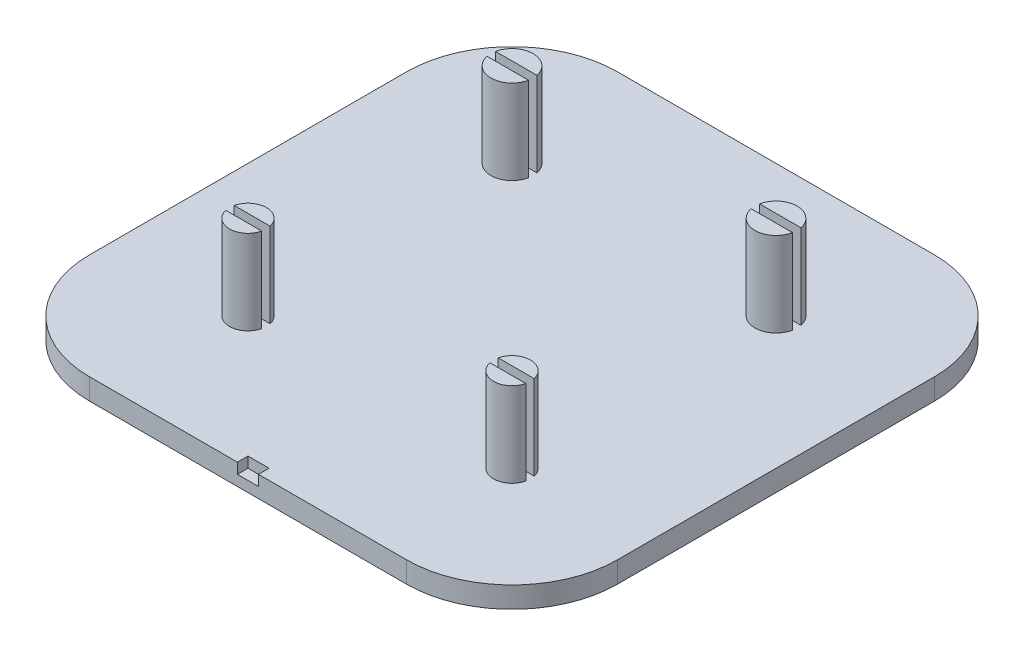
from build123d import *

# Parameters (mm, degrees)
SKETCH1_W           = 50
SKETCH1_H           = 50
BOSS_EXTRUDE1_DEPTH = 2
BOSS_EXTRUDE2_DEPTH = 8
FILLET1_R           = 10
CUT_EXTRUDE1_DEPTH  = 1


with BuildPart() as part:
    # Sketch1 → Boss-Extrude1 (new body)
    with BuildSketch(Plane(origin=(0, 0, 0), x_dir=(1, 0, 0), z_dir=(0, 1, 0))):
        with Locations((-178.886902591, -23.537255169)):
            Rectangle(SKETCH1_W, SKETCH1_H)
    extrude(amount=BOSS_EXTRUDE1_DEPTH)

    # Sketch2 → Boss-Extrude2 (add)
    with BuildSketch(Plane(origin=(0, 2, 0), x_dir=(1, 0, 0), z_dir=(0, 1, 0))):
        with BuildLine():
            Line((-189.683230088, -36.437255169), (-193.090575095, -36.437255169))
            ThreePointArc((-193.090575095, -36.437255169), (-191.386902591, -37.787255169), (-189.683230088, -36.437255169))
        make_face()
        with BuildLine():
            Line((-193.090575095, -35.637255169), (-191.386902591, -35.637255169))
            Line((-191.386902591, -35.637255169), (-189.683230088, -35.637255169))
            ThreePointArc((-189.683230088, -35.637255169), (-191.386902591, -34.287255169), (-193.090575095, -35.637255169))
        make_face()
        with BuildLine():
            Line((-168.090575095, -35.637255169), (-166.386902591, -35.637255169))
            Line((-166.386902591, -35.637255169), (-164.683230088, -35.637255169))
            ThreePointArc((-164.683230088, -35.637255169), (-166.386902591, -34.287255169), (-168.090575095, -35.637255169))
        make_face()
        with BuildLine():
            Line((-164.683230088, -36.437255169), (-168.090575095, -36.437255169))
            ThreePointArc((-168.090575095, -36.437255169), (-166.386902591, -37.787255169), (-164.683230088, -36.437255169))
        make_face()
        with BuildLine():
            Line((-193.346494385, -10.637255169), (-191.386902591, -10.637255169))
            Line((-191.386902591, -10.637255169), (-189.427310797, -10.637255169))
            ThreePointArc((-189.427310797, -10.637255169), (-191.386902591, -9.037255169), (-193.346494385, -10.637255169))
        make_face()
        with BuildLine():
            Line((-189.427310797, -11.437255169), (-193.346494385, -11.437255169))
            ThreePointArc((-193.346494385, -11.437255169), (-191.386902591, -13.037255169), (-189.427310797, -11.437255169))
        make_face()
        with BuildLine():
            Line((-168.346494385, -10.637255169), (-166.386902591, -10.637255169))
            Line((-166.386902591, -10.637255169), (-164.427310797, -10.637255169))
            ThreePointArc((-164.427310797, -10.637255169), (-166.386902591, -9.037255169), (-168.346494385, -10.637255169))
        make_face()
        with BuildLine():
            Line((-164.427310797, -11.437255169), (-168.346494385, -11.437255169))
            ThreePointArc((-168.346494385, -11.437255169), (-166.386902591, -13.037255169), (-164.427310797, -11.437255169))
        make_face()
    extrude(amount=BOSS_EXTRUDE2_DEPTH)

    # Fillet1
    fillet1_edges = [part.edges().sort_by_distance(p)[0] for p in [
        (-203.886902591, 1, -1.462744831),
        (-153.886902591, 1, -1.462744831),
        (-153.886902591, 1, 48.537255169),
        (-203.886902591, 1, 48.537255169),
    ]]
    fillet(fillet1_edges, radius=FILLET1_R)

    # Sketch3 → Cut-Extrude1 (cut)
    with BuildSketch(Plane(origin=(0, 2, 0), x_dir=(1, 0, 0), z_dir=(0, 1, 0))):
        Polygon((-177.886902591, -47.537255169), (-178.886902591, -47.537255169), (-179.886902591, -47.537255169), (-179.886902591, -48.537255169), (-177.886902591, -48.537255169), align=None)
    extrude(amount=-CUT_EXTRUDE1_DEPTH, mode=Mode.SUBTRACT)


solid = part.part
